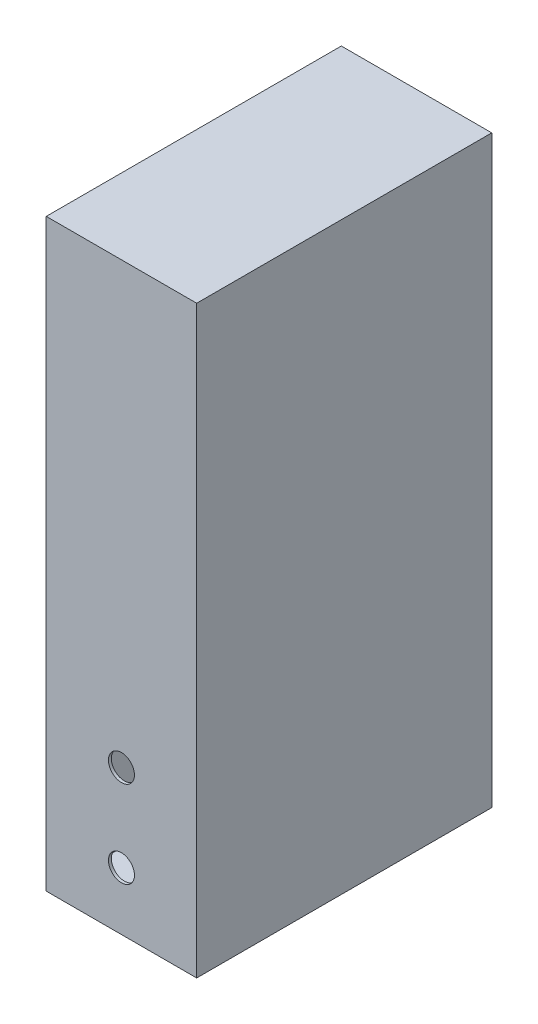
from build123d import *

# Parameters (mm, degrees)
ESQUISSE1_W             = 52
ESQUISSE1_H             = 202
BOSS_EXTRU_1_DEPTH      = 102
COQUE1_T                = -1
ESQUISSE2_W             = 50
ESQUISSE2_H             = 200
BOSS_EXTRU_2_DEPTH      = 1
ESQUISSE3_R             = 4.5
ENL_V_MAT_EXTRU_1_DEPTH = 1


with BuildPart() as part:
    # Esquisse1 → Boss.-Extru.1 (new body)
    with BuildSketch(Plane.XY):
        Rectangle(ESQUISSE1_W, ESQUISSE1_H)
    extrude(amount=BOSS_EXTRU_1_DEPTH)

    # Coque1
    coque1_openings = [part.faces().sort_by_distance(p)[0] for p in [
        (0, 0, 102),
    ]]
    offset(amount=COQUE1_T, openings=coque1_openings, kind=Kind.INTERSECTION)

    # Esquisse2 → Boss.-Extru.2 (add)
    with BuildSketch(Plane.XY.offset(102)):
        Rectangle(ESQUISSE2_W, ESQUISSE2_H)
    extrude(amount=-BOSS_EXTRU_2_DEPTH)

    # Esquisse3 → Enlèv. mat.-Extru.1 (cut)
    with BuildSketch(Plane.XY.offset(102)):
        with Locations((0, -81)):
            Circle(ESQUISSE3_R)
        with Locations((0, -51)):
            Circle(ESQUISSE3_R)
    extrude(amount=-ENL_V_MAT_EXTRU_1_DEPTH, mode=Mode.SUBTRACT)


solid = part.part
